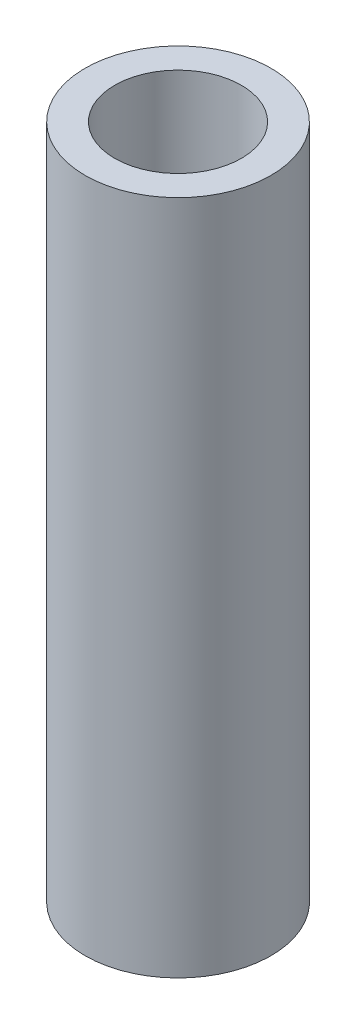
from build123d import *

# Parameters (mm, degrees)
SKETCH_1_R      = 11
SKETCH_1_R_2    = 7.5
EXTRUDE_1_DEPTH = 80


with BuildPart() as part:
    # 草圖1 → 填料-伸長1 (new body)
    with BuildSketch(Plane(origin=(0, 0, 0), x_dir=(1, 0, 0), z_dir=(0, 1, 0))):
        with Locations(Location((0, 0, 0), (0, 0, 270))):
            Circle(SKETCH_1_R)
        with Locations(Location((0, 0, 0), (0, 0, 270))):
            Circle(SKETCH_1_R_2, mode=Mode.SUBTRACT)
    extrude(amount=EXTRUDE_1_DEPTH)


solid = part.part
